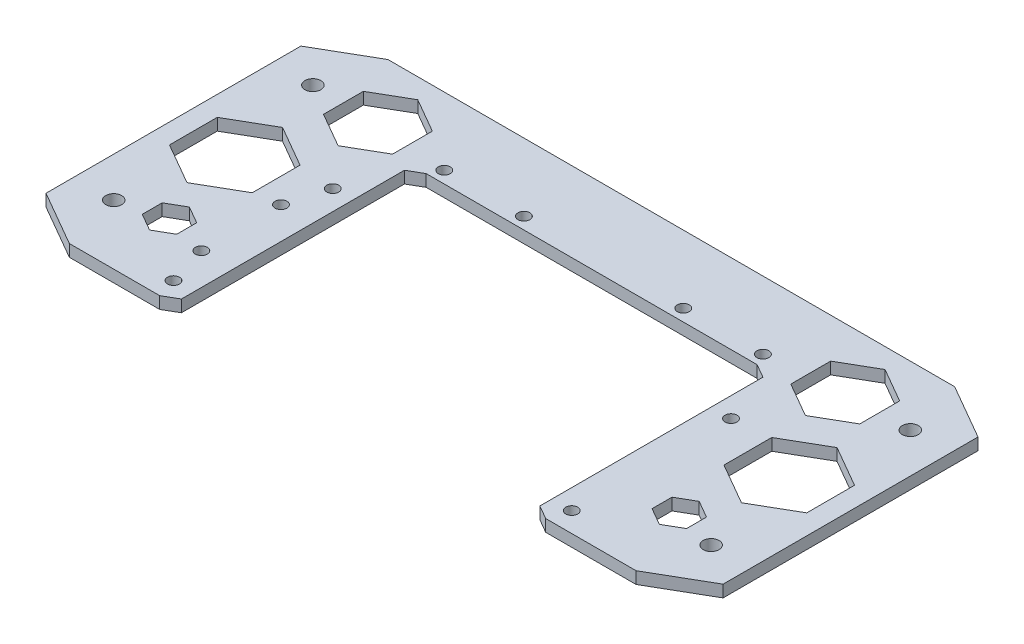
from build123d import *
from OCP.BRepFilletAPI import BRepFilletAPI_MakeChamfer

# Parameters (mm, degrees)
SKETCH_1_W          = 170
SKETCH_1_H          = 80
SKETCH_1_R          = 2
EXTRUDE_1_DEPTH     = 3
SKETCH_2_R          = 1.5
SKETCH_2_W          = 90
SKETCH_2_H          = 60
CUT_EXTRUDE_1_DEPTH = 188.906891837
SKETCH_3_R          = 1.5
CUT_EXTRUDE_2_DEPTH = 5
CUT_EXTRUDE_3_DEPTH = 10
CHAMFER_1_SIZE      = 2
CHAMFER_1_SIZE2     = 3.464101615
CHAMFER_2_SIZE      = 8
CHAMFER_2_SIZE2     = 13.856406461


with BuildPart() as part:
    # 草图1 → 凸台-拉伸1 (new body)
    with BuildSketch(Plane(origin=(0, 0, 0), x_dir=(1, 0, 0), z_dir=(0, 1, 0))):
        with Locations((85, 40)):
            Rectangle(SKETCH_1_W, SKETCH_1_H)
        with Locations(Location((10, 65, 0), (0, 0, 270))):
            Circle(SKETCH_1_R, mode=Mode.SUBTRACT)
        with Locations(Location((10, 15, 0), (0, 0, 90))):
            Circle(SKETCH_1_R, mode=Mode.SUBTRACT)
        with Locations(Location((160, 15, 0), (0, 0, 270))):
            Circle(SKETCH_1_R, mode=Mode.SUBTRACT)
        with Locations(Location((160, 65, 0), (0, 0, 90))):
            Circle(SKETCH_1_R, mode=Mode.SUBTRACT)
    extrude(amount=EXTRUDE_1_DEPTH)

    # 草图2 → 切除-拉伸1 (cut, through all)
    with BuildSketch(Plane(origin=(0, 3, 0), x_dir=(1, 0, 0), z_dir=(0, 1, 0))):
        with Locations(Location((35, 45, 0), (0, 0, 270))):
            Circle(SKETCH_2_R)
        with Locations(Location((35, 5, 0), (0, 0, 270))):
            Circle(SKETCH_2_R)
        with Locations(Location((135, 5, 0), (0, 0, 90))):
            Circle(SKETCH_2_R)
        with Locations(Location((135, 45, 0), (0, 0, 90))):
            Circle(SKETCH_2_R)
        with Locations(Location((45, 63, 0), (0, 0, 270))):
            Circle(SKETCH_2_R)
        with Locations(Location((65, 63, 0), (0, 0, 270))):
            Circle(SKETCH_2_R)
        with Locations(Location((105, 63, 0), (0, 0, 90))):
            Circle(SKETCH_2_R)
        with Locations(Location((125, 63, 0), (0, 0, 90))):
            Circle(SKETCH_2_R)
        with Locations((85, 30)):
            Rectangle(SKETCH_2_W, SKETCH_2_H)
    extrude(amount=-CUT_EXTRUDE_1_DEPTH, mode=Mode.SUBTRACT)

    # 草图3 → 切除-拉伸2 (cut)
    with BuildSketch(Plane(origin=(0, 3, 0), x_dir=(1, 0, 0), z_dir=(0, 1, 0))):
        with Locations(Location((32, 15, 0), (0, 0, 270))):
            Circle(SKETCH_3_R)
        with Locations(Location((32, 35, 0), (0, 0, 270))):
            Circle(SKETCH_3_R)
    extrude(amount=-CUT_EXTRUDE_2_DEPTH, mode=Mode.SUBTRACT)

    # 草图5 → 切除-拉伸3 (cut)
    with BuildSketch(Plane(origin=(0, 3, 0), x_dir=(1, 0, 0), z_dir=(0, 1, 0))):
        Polygon((15.391630359, 28.000778829), (25.783260719, 34.000389415), (25.783260719, 45.999610585), (15.391630359, 51.999221171), (5, 45.999610585), (5, 34.000389415), align=None)
        Polygon((35, 60), (35, 70), (26.339745962, 75), (17.679491924, 70), (17.679491924, 60), (26.339745962, 55), align=None)
        Polygon((21, 13), (25.330127019, 15.5), (25.330127019, 20.5), (21, 23), (16.669872981, 20.5), (16.669872981, 15.5), align=None)
        Polygon((153.330127019, 15.5), (149, 13), (144.669872981, 15.5), (144.669872981, 20.5), (149, 23), (153.330127019, 20.5), align=None)
        Polygon((143.660254038, 55), (135, 60), (135, 70), (143.660254038, 75), (152.320508076, 70), (152.320508076, 60), align=None)
        Polygon((165, 34.000389415), (154.608369641, 28.000778829), (144.216739281, 34.000389415), (144.216739281, 45.999610585), (154.608369641, 51.999221171), (165, 45.999610585), align=None)
    extrude(amount=-CUT_EXTRUDE_3_DEPTH, mode=Mode.SUBTRACT)

    # 倒角1: one chamfer whose edges measure the first distance from different faces: ONE call of the kernel's chamfer builder (chamfer() names one face for all edges)
    chamfer_1_edges_1 = [part.edges().sort_by_distance(p)[0] for p in [
        (40, 1.5, 0),
        (40, 1.5, -60),
    ]]
    chamfer_1_side_1 = [part.faces().sort_by_distance(p)[0] for p in [
        (40, 1.5, -30),
    ]]
    chamfer_1_edges_2 = [part.edges().sort_by_distance(p)[0] for p in [
        (130, 1.5, -60),
        (130, 1.5, 0),
    ]]
    chamfer_1_side_2 = [part.faces().sort_by_distance(p)[0] for p in [
        (130, 1.5, -30),
    ]]
    chamfer_1 = BRepFilletAPI_MakeChamfer(part.part.solid().wrapped)
    for e in chamfer_1_edges_1:
        chamfer_1.Add(CHAMFER_1_SIZE, CHAMFER_1_SIZE2, e.wrapped, chamfer_1_side_1[0].wrapped)  # the first distance lies on this face
    for e in chamfer_1_edges_2:
        chamfer_1.Add(CHAMFER_1_SIZE, CHAMFER_1_SIZE2, e.wrapped, chamfer_1_side_2[0].wrapped)  # the first distance lies on this face
    add(Compound.cast(chamfer_1.Shape()), mode=Mode.REPLACE)

    # 倒角2: one chamfer whose edges measure the first distance from different faces: ONE call of the kernel's chamfer builder (chamfer() names one face for all edges)
    chamfer_2_edges_1 = [part.edges().sort_by_distance(p)[0] for p in [
        (0, 1.5, -80),
        (0, 1.5, 0),
    ]]
    chamfer_2_side_1 = [part.faces().sort_by_distance(p)[0] for p in [
        (0, 1.5, -40),
    ]]
    chamfer_2_edges_2 = [part.edges().sort_by_distance(p)[0] for p in [
        (170, 1.5, -80),
        (170, 1.5, 0),
    ]]
    chamfer_2_side_2 = [part.faces().sort_by_distance(p)[0] for p in [
        (170, 1.5, -40),
    ]]
    chamfer_2 = BRepFilletAPI_MakeChamfer(part.part.solid().wrapped)
    for e in chamfer_2_edges_1:
        chamfer_2.Add(CHAMFER_2_SIZE, CHAMFER_2_SIZE2, e.wrapped, chamfer_2_side_1[0].wrapped)  # the first distance lies on this face
    for e in chamfer_2_edges_2:
        chamfer_2.Add(CHAMFER_2_SIZE, CHAMFER_2_SIZE2, e.wrapped, chamfer_2_side_2[0].wrapped)  # the first distance lies on this face
    add(Compound.cast(chamfer_2.Shape()), mode=Mode.REPLACE)


solid = part.part
